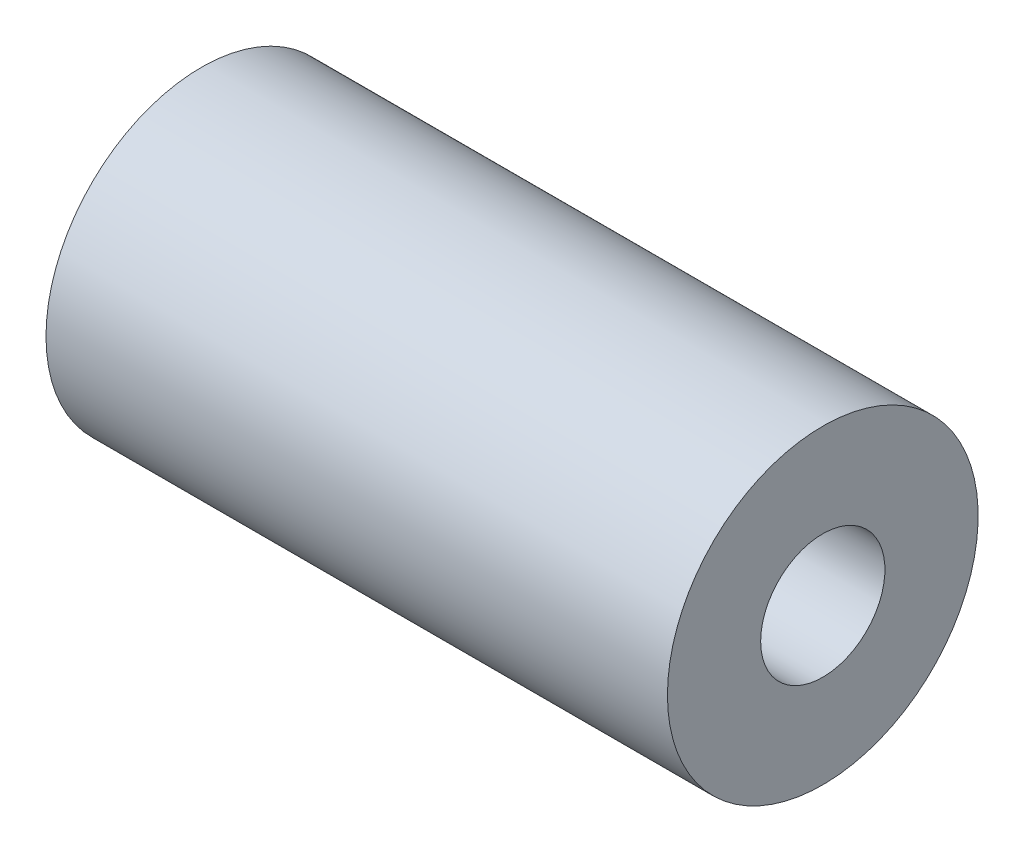
from build123d import *

# Parameters (mm, degrees)
ESQUISSE1_W             = 15
ESQUISSE1_H             = 4.5
ESQUISSE2_R             = 2
ENL_V_MAT_EXTRU_1_DEPTH = 32.819805153


with BuildPart() as part:
    # Esquisse1 → Révolution1 (revolve)
    with BuildSketch(Plane.XY, mode=Mode.PRIVATE) as r_volution1_sk:
        Polygon((0, 7.5), (0, 2.5), (15, 2.5), (15, 3), (15, 7.5), align=None)
        with Locations((22.5, 5.25)):
            Rectangle(ESQUISSE1_W, ESQUISSE1_H)
    revolve(r_volution1_sk.sketch.rotate(Axis((-26.945391005, 0, 0), (1, 0, 0)), 90), axis=Axis((-26.945391005, 0, 0), (1, 0, 0)))

    # Esquisse2 → Enlèv. mat.-Extru.1 (cut, through all)
    with BuildSketch(Plane(origin=(0, 0, 0), x_dir=(1, 0, 0), z_dir=(0, 1, 0))):
        with Locations(Location((7, 0, 0), (0, 0, 270))):
            Circle(ESQUISSE2_R)
        with Locations(Location((23, 0, 0), (0, 0, 270))):
            Circle(ESQUISSE2_R)
    extrude(amount=-ENL_V_MAT_EXTRU_1_DEPTH, mode=Mode.SUBTRACT)


solid = part.part
